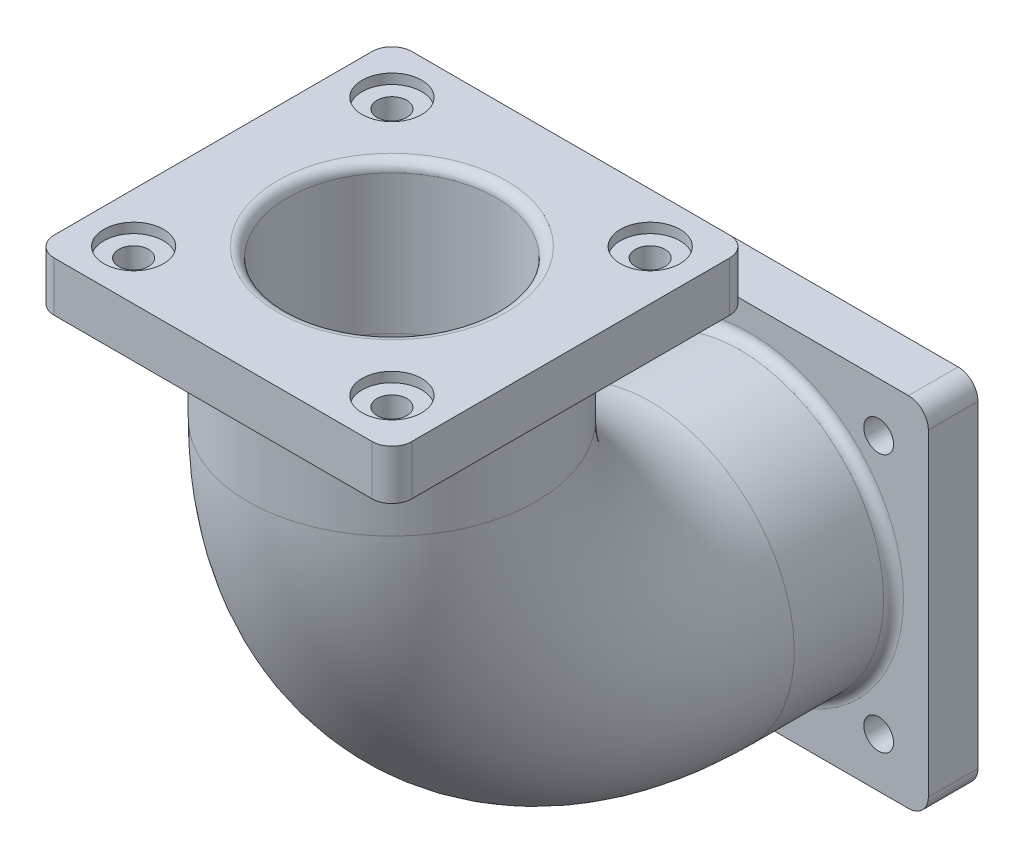
from build123d import *

# Parameters (mm, degrees)
SKETCH1_R            = 145
SKETCH1_R_2          = 105
BOSS_EXTRUDE1_START  = -50
SKETCH3_R            = 105
BOSS_EXTRUDE1_DEPTH  = 50
FILLET1_R            = 10
SKETCH4_R            = 105
BOSS_EXTRUDE2_DEPTH  = 50
FILLET2_R            = 10
SKETCH5_R            = 15
CUT_EXTRUDE1_DEPTH   = 50
SKETCH6_R            = 30
CUT_EXTRUDE2_DEPTH   = 10
LPATTERN3_COUNT      = 2
LPATTERN3_PITCH      = 260
LPATTERN3_COUNT_DIR2 = 2
LPATTERN3_PITCH_DIR2 = 260
FILLET3_R            = 10
SKETCH12_R           = 15
CUT_EXTRUDE5_DEPTH   = 50
SKETCH13_R           = 30
CUT_EXTRUDE6_DEPTH   = 10
LPATTERN5_COUNT      = 2
LPATTERN5_PITCH      = 260
LPATTERN5_COUNT_DIR2 = 2
LPATTERN5_PITCH_DIR2 = 260
FILLET4_R            = 10


with BuildPart() as part:
    # Sweep1: sweep along a path in Sketch2
    with BuildLine(Plane(origin=(0, 0, 0), x_dir=(0, 0, -1), z_dir=(1, 0, 0))) as sweep1_path:
        Line((0, 0), (-150, 0))
        ThreePointArc((-150, 0), (-333.847763109, 76.152236891), (-410, 260))
        Line((-410, 260), (-410, 410))
    # Sketch1 → Sweep1 (sweep)
    with BuildSketch(Plane.XY):
        Circle(SKETCH1_R)
        Circle(SKETCH1_R_2, mode=Mode.SUBTRACT)
    sweep(path=sweep1_path.line)

    # Sketch3 → Boss-Extrude1 (add)
    with BuildSketch(Plane(origin=(0, 0, 0), x_dir=(-1, 0, 0), z_dir=(0, 0, -1)).offset(BOSS_EXTRUDE1_START)):
        with BuildLine():
            Line((-160, -180), (160, -180))
            ThreePointArc((160, -180), (174.142135624, -174.142135624), (180, -160))
            Line((180, -160), (180, 160))
            ThreePointArc((180, 160), (174.142135624, 174.142135624), (160, 180))
            Line((160, 180), (-160, 180))
            ThreePointArc((-160, 180), (-174.142135624, 174.142135624), (-180, 160))
            Line((-180, 160), (-180, -160))
            ThreePointArc((-180, -160), (-174.142135624, -174.142135624), (-160, -180))
        make_face()
        with Locations(Location((0, 0, 0), (0, 0, 270))):
            Circle(SKETCH3_R, mode=Mode.SUBTRACT)
    extrude(amount=BOSS_EXTRUDE1_DEPTH)

    # Fillet1
    fillet1_edges = [part.edges().sort_by_distance(p)[0] for p in [
        (-105, 0, 0),
    ]]
    fillet(fillet1_edges, radius=FILLET1_R)

    # Sketch4 → Boss-Extrude2 (add)
    with BuildSketch(Plane(origin=(0, 410, 0), x_dir=(1, 0, 0), z_dir=(0, 1, 0))):
        with BuildLine():
            Line((-160, -590), (160, -590))
            ThreePointArc((160, -590), (174.142135624, -584.142135624), (180, -570))
            Line((180, -570), (180, -250))
            ThreePointArc((180, -250), (174.142135624, -235.857864376), (160, -230))
            Line((160, -230), (-160, -230))
            ThreePointArc((-160, -230), (-174.142135624, -235.857864376), (-180, -250))
            Line((-180, -250), (-180, -570))
            ThreePointArc((-180, -570), (-174.142135624, -584.142135624), (-160, -590))
        make_face()
        with Locations(Location((0, -410, 0), (0, 0, 270))):
            Circle(SKETCH4_R, mode=Mode.SUBTRACT)
    extrude(amount=-BOSS_EXTRUDE2_DEPTH)

    # Fillet2
    fillet2_edges = [part.edges().sort_by_distance(p)[0] for p in [
        (-105, 410, 410),
    ]]
    fillet(fillet2_edges, radius=FILLET2_R)

    # Sketch5 → Cut-Extrude1 (cut)
    with BuildSketch(Plane(origin=(0, 0, 0), x_dir=(-1, 0, 0), z_dir=(0, 0, -1))):
        with Locations((-130, 130)):
            Circle(SKETCH5_R)
    cut_extrude1 = extrude(amount=-CUT_EXTRUDE1_DEPTH, mode=Mode.SUBTRACT)

    # Sketch6 → Cut-Extrude2 (cut)
    with BuildSketch(Plane(origin=(0, 0, 0), x_dir=(-1, 0, 0), z_dir=(0, 0, -1))):
        with Locations((-130, 130)):
            Circle(SKETCH6_R)
    cut_extrude2 = extrude(amount=-CUT_EXTRUDE2_DEPTH, mode=Mode.SUBTRACT)

    # LPattern3: Cut-Extrude1, Cut-Extrude2 2 × 2
    with Locations(*[(-i * LPATTERN3_PITCH, -j * LPATTERN3_PITCH_DIR2, 0) for i in range(LPATTERN3_COUNT) for j in range(LPATTERN3_COUNT_DIR2) if (i, j) != (0, 0)]):
        add(cut_extrude1, mode=Mode.SUBTRACT)
        add(cut_extrude2, mode=Mode.SUBTRACT)

    # Fillet3
    fillet3_edges = [part.edges().sort_by_distance(p)[0] for p in [
        (-145, 0, 50),
    ]]
    fillet(fillet3_edges, radius=FILLET3_R)

    # Sketch12 → Cut-Extrude5 (cut)
    with BuildSketch(Plane(origin=(0, 410, 0), x_dir=(1, 0, 0), z_dir=(0, 1, 0))):
        with Locations(Location((-130, -280, 0), (0, 0, 270))):
            Circle(SKETCH12_R)
    cut_extrude5 = extrude(amount=-CUT_EXTRUDE5_DEPTH, mode=Mode.SUBTRACT)

    # Sketch13 → Cut-Extrude6 (cut)
    with BuildSketch(Plane(origin=(0, 410, 0), x_dir=(1, 0, 0), z_dir=(0, 1, 0))):
        with Locations(Location((-130, -280, 0), (0, 0, 270))):
            Circle(SKETCH13_R)
    cut_extrude6 = extrude(amount=-CUT_EXTRUDE6_DEPTH, mode=Mode.SUBTRACT)

    # LPattern5: Cut-Extrude5, Cut-Extrude6 2 × 2
    with Locations(*[(i * LPATTERN5_PITCH, 0, j * LPATTERN5_PITCH_DIR2) for i in range(LPATTERN5_COUNT) for j in range(LPATTERN5_COUNT_DIR2) if (i, j) != (0, 0)]):
        add(cut_extrude5, mode=Mode.SUBTRACT)
        add(cut_extrude6, mode=Mode.SUBTRACT)

    # Fillet4
    fillet4_edges = [part.edges().sort_by_distance(p)[0] for p in [
        (-145, 360, 410),
    ]]
    fillet(fillet4_edges, radius=FILLET4_R)


solid = part.part
